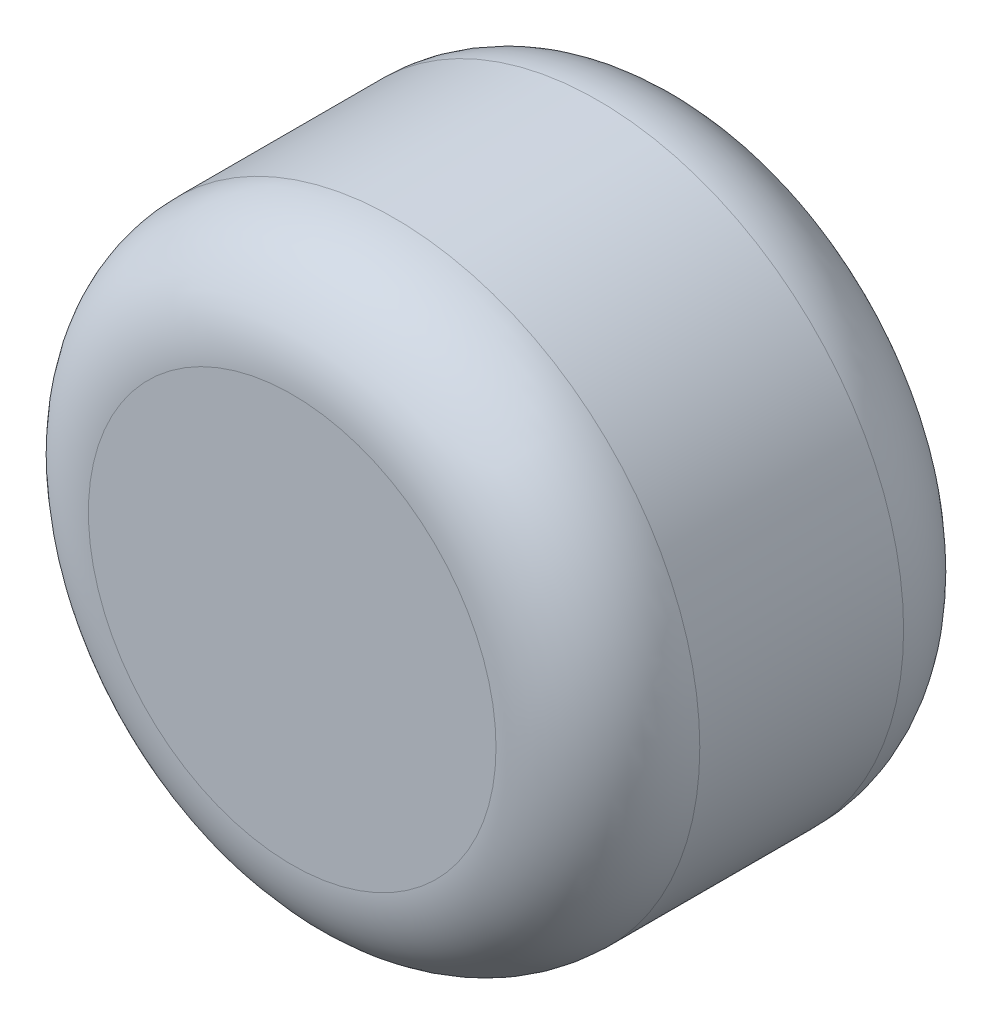
from build123d import *

# Parameters (mm, degrees)
ESQUISSE1_R        = 76.2
BOSS_EXTRU_1_DEPTH = 101.6
CONG_1_R           = 25.4


with BuildPart() as part:
    # Esquisse1 → Boss.-Extru.1 (new body)
    with BuildSketch(Plane.XY):
        Circle(ESQUISSE1_R)
    extrude(amount=BOSS_EXTRU_1_DEPTH)

    # Congé1
    cong_1_edges = [part.edges().sort_by_distance(p)[0] for p in [
        (-76.2, 0, 0),
        (-76.2, 0, 101.6),
    ]]
    fillet(cong_1_edges, radius=CONG_1_R)


solid = part.part
